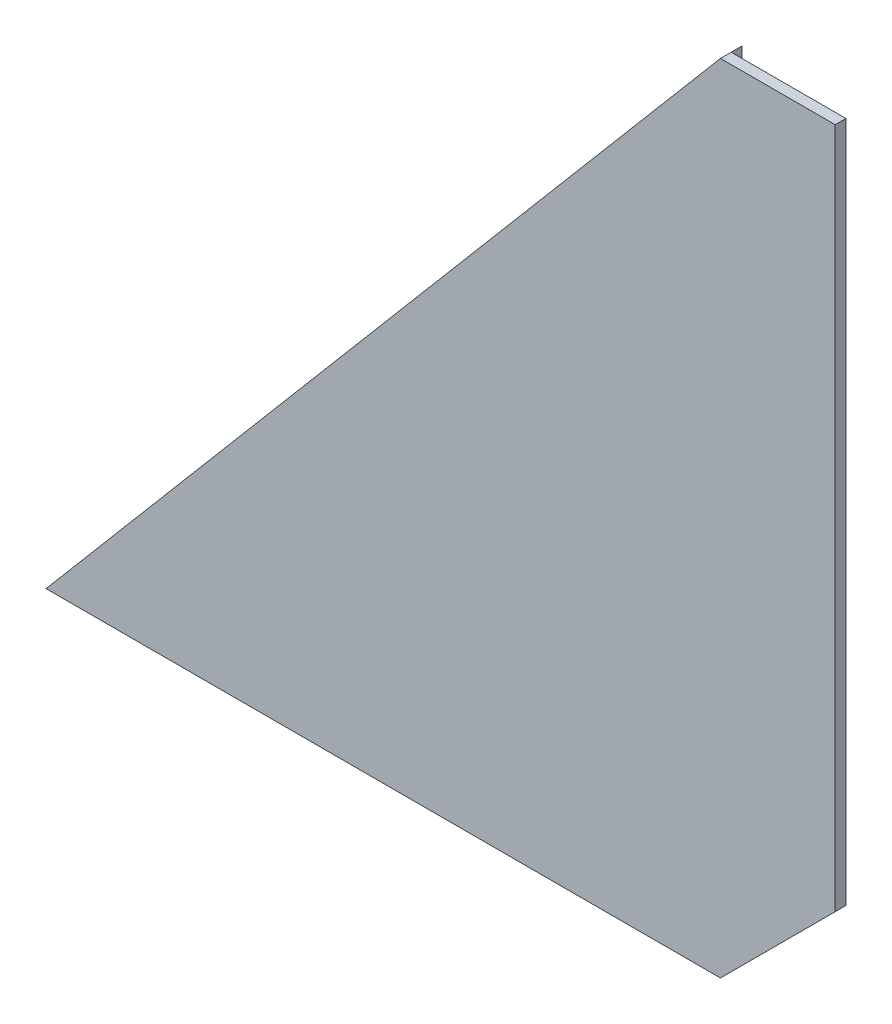
from build123d import *

# Parameters (mm, degrees)
EXTRUDE_1_DEPTH = 1.5
EXTRUDE_2_DEPTH = 3


with BuildPart() as part:
    # 草圖1 → 擠出1 (new body)
    with BuildSketch(Plane.XY):
        Polygon((-16, 0), (0, 16), (0, 111), (-16, 111), (-16, 97.073509127), (-98.206395117, 0), align=None)
    extrude(amount=EXTRUDE_1_DEPTH)

    # 草圖2 → 擠出2 (add)
    with BuildSketch(Plane.XY):
        Polygon((-110, 0), (-98.206395117, 0), (-16, 97.073509127), (-16, 111), align=None)
    extrude(amount=EXTRUDE_2_DEPTH)


with BuildPart() as body_2:
    # 鏡射1: mirrored copy
    add(part.part.mirror(Plane(origin=(-44.219505569, 22.2, 0), x_dir=(1, 0, 0), z_dir=(0, 0, 1))))


solid = body_2.part
